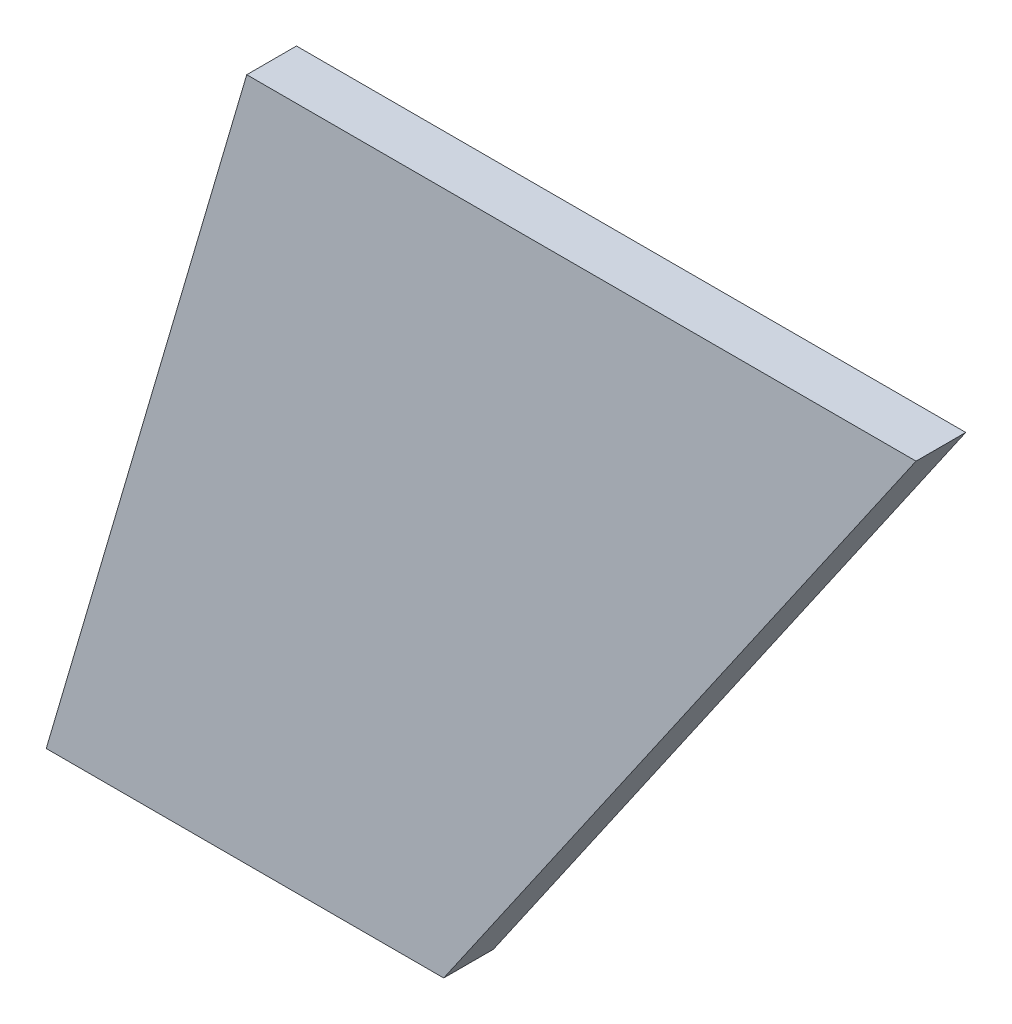
from build123d import *

# Parameters (mm, degrees)
BOSS_EXTRUDE1_DEPTH = 9.525


with BuildPart() as part:
    # Sketch1 → Boss-Extrude1 (new body)
    with BuildSketch(Plane.XY):
        Polygon((-107.351338813, 48.794909363), (-68.935877084, 179.800489363), (59.293482916, 179.800489363), (-31.202138813, 48.794909363), align=None)
    extrude(amount=-BOSS_EXTRUDE1_DEPTH)


solid = part.part
